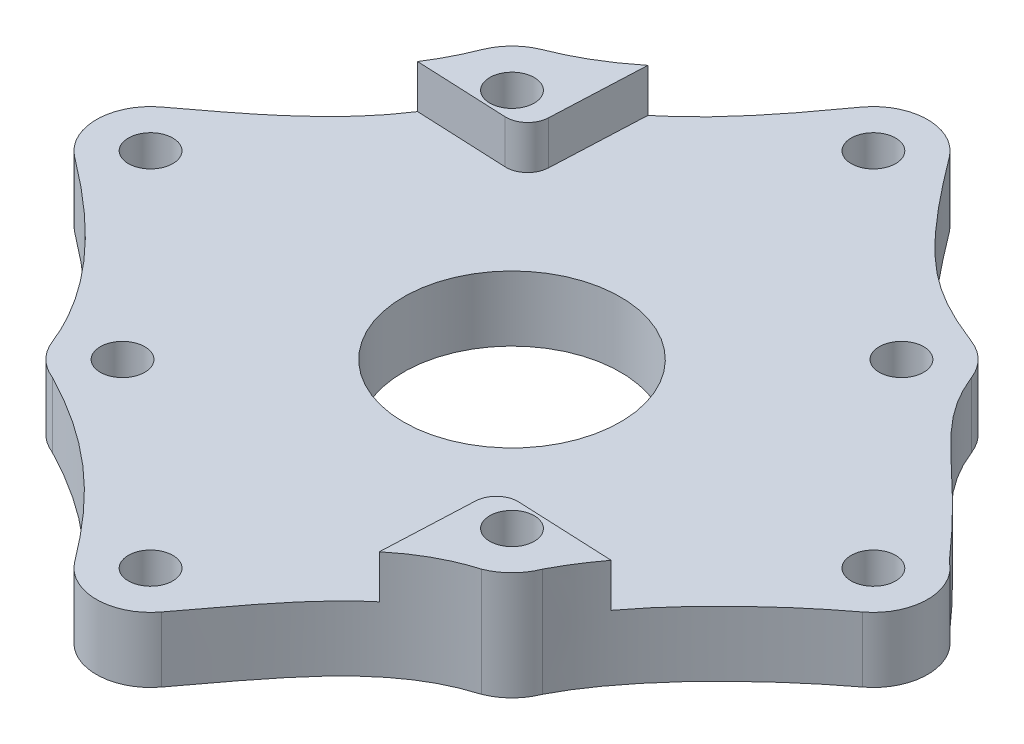
from build123d import *

# Parameters (mm, degrees)
SKETCH2_R           = 2.05
SKETCH2_R_2         = 10
BOSS_EXTRUDE1_DEPTH = 6
SKETCH4_R           = 2.05
BOSS_EXTRUDE2_DEPTH = 4


with BuildPart() as part:
    # Sketch2 → Boss-Extrude1 (new body)
    with BuildSketch(Plane(origin=(0, 0, 0), x_dir=(1, 0, 0), z_dir=(0, 1, 0))):
        with BuildLine():
            ThreePointArc((4, 36.333013665), (0, 38.333013665), (-4, 36.333013665))
            add(Edge.make_bspline(
                [(-19.327049621, 22.155476746), (-12.763587626, 24.730553465), (-8.427522415, 30.156498127), (-4, 36.333013665)],
                knots=[0, 0, 0, 0, 1, 1, 1, 1], degree=3))
            ThreePointArc((-19.327049621, 22.155476746), (-21.03642674, 21.03642674), (-22.155476746, 19.327049621))
            add(Edge.make_bspline(
                [(-36.333013665, 4), (-30.505064465, 8.3709619), (-24.839849632, 12.485009038), (-22.155476746, 19.327049621)],
                knots=[0, 0, 0, 0, 1, 1, 1, 1], degree=3))
            ThreePointArc((-36.333013665, 4), (-38.333013665, 0), (-36.333013665, -4))
            add(Edge.make_bspline(
                [(-36.333013665, -4), (-30.114152071, -8.664146195), (-24.942929086, -13.853392219), (-22.615096154, -19.786669029)],
                knots=[0, 0, 0, 0, 1, 1, 1, 1], degree=3))
            ThreePointArc((-22.615096154, -19.786669029), (-21.496046148, -21.496046148), (-19.786669029, -22.615096154))
            add(Edge.make_bspline(
                [(-19.786669029, -22.615096154), (-12.829111765, -26.205220822), (-8.517950555, -30.309079592), (-4, -36.333013665)],
                knots=[0, 0, 0, 0, 1, 1, 1, 1], degree=3))
            ThreePointArc((-4, -36.333013665), (0, -38.333013665), (4, -36.333013665))
            add(Edge.make_bspline(
                [(4, -36.333013665), (8.986714341, -29.68406121), (12.829629407, -24.073808118), (19.327049621, -22.155476746)],
                knots=[0, 0, 0, 0, 1, 1, 1, 1], degree=3))
            ThreePointArc((19.327049621, -22.155476746), (21.03642674, -21.03642674), (22.155476746, -19.327049621))
            add(Edge.make_bspline(
                [(22.155476746, -19.327049621), (25.018370869, -13.753003663), (31.354300327, -7.734035003), (36.333013665, -4)],
                knots=[0, 0, 0, 0, 1, 1, 1, 1], degree=3))
            ThreePointArc((36.333013665, -4), (38.333013665, 0), (36.333013665, 4))
            add(Edge.make_bspline(
                [(36.333013665, 4), (28.974985707, 12.434827797), (24.849369186, 14.09186156), (22.615096154, 19.786669029)],
                knots=[0, 0, 0, 0, 1, 1, 1, 1], degree=3))
            ThreePointArc((22.615096154, 19.786669029), (21.496046148, 21.496046148), (19.786669029, 22.615096154))
            add(Edge.make_bspline(
                [(4, 36.333013665), (10.902815442, 27.129259742), (13.673195705, 25.013626509), (19.786669029, 22.615096154)],
                knots=[0, 0, 0, 0, 1, 1, 1, 1], degree=3))
        make_face()
        with Locations(Location((0, 33.333013665, 0), (0, 0, 270))):
            Circle(SKETCH2_R, mode=Mode.SUBTRACT)
        with Locations(Location((33.333013665, 0, 0), (0, 0, 270))):
            Circle(SKETCH2_R, mode=Mode.SUBTRACT)
        with Locations(Location((0, -33.333013665, 0), (0, 0, 270))):
            Circle(SKETCH2_R, mode=Mode.SUBTRACT)
        with Locations(Location((-33.333013665, 0, 0), (0, 0, 270))):
            Circle(SKETCH2_R, mode=Mode.SUBTRACT)
        with Locations(Location((0, 0, 0), (0, 0, 270))):
            Circle(SKETCH2_R_2, mode=Mode.SUBTRACT)
        with Locations(Location((-17.500892834, 17.500892834, 0), (0, 0, 270))):
            Circle(SKETCH2_R, mode=Mode.SUBTRACT)
        with Locations(Location((-17.960512242, -17.960512242, 0), (0, 0, 270))):
            Circle(SKETCH2_R, mode=Mode.SUBTRACT)
        with Locations(Location((17.960512242, 17.960512242, 0), (0, 0, 270))):
            Circle(SKETCH2_R, mode=Mode.SUBTRACT)
        with Locations(Location((17.500892834, -17.500892834, 0), (0, 0, 270))):
            Circle(SKETCH2_R, mode=Mode.SUBTRACT)
    extrude(amount=BOSS_EXTRUDE1_DEPTH)

    # Sketch4 → Boss-Extrude2 (add)
    # profile 1 of 2: a face of its own
    with BuildSketch(Plane(origin=(0, 6, 0), x_dir=(1, 0, 0), z_dir=(0, 1, 0))):
        with BuildLine():
            Line((15.707753118, -15.068373573), (24.606369586, -15.466232362))
            add(Edge.make_bspline(
                [(22.155476746, -19.327049621), (22.810102957, -18.052494423), (23.646316442, -16.75467649), (24.606369586, -15.466232362)],
                knots=[0, 0, 0, 0, 0.228658897, 0.228658897, 0.228658897, 0.228658897], degree=3))
            ThreePointArc((22.155476746, -19.327049621), (21.03642674, -21.03642674), (19.327049621, -22.155476746))
            add(Edge.make_bspline(
                [(13.240425147, -25.476068549), (15.048020958, -23.982995667), (17.020234836, -22.836552469), (19.327049621, -22.155476746)],
                knots=[0.644964508, 0.644964508, 0.644964508, 0.644964508, 1, 1, 1, 1], degree=3))
            Line((13.240425147, -25.476068549), (13.620417999, -16.977046436))
            ThreePointArc((13.620417999, -16.977046436), (14.268786465, -15.590408746), (15.707753118, -15.068373573))
        make_face()
        with Locations(Location((17.500892834, -17.500892834, 0), (0, 0, 270))):
            Circle(SKETCH4_R, mode=Mode.SUBTRACT)
    # profile 2 of 2: a face of its own
    with BuildSketch(Plane(origin=(0, 6, 0), x_dir=(1, 0, 0), z_dir=(0, 1, 0))):
        with BuildLine():
            Line((-13.228436316, 25.756908597), (-13.620382808, 16.977307181))
            ThreePointArc((-13.620382808, 16.977307181), (-14.2686581, 15.590625928), (-15.707589672, 15.068494066))
            Line((-15.707589672, 15.068494066), (-24.152657128, 15.445506006))
            add(Edge.make_bspline(
                [(-22.155476746, 19.327049621), (-22.704535018, 17.927587199), (-23.378300091, 16.642253384), (-24.152657128, 15.445506006)],
                knots=[0, 0, 0, 0, 0.204538749, 0.204538749, 0.204538749, 0.204538749], degree=3))
            ThreePointArc((-22.155476746, 19.327049621), (-21.03642674, 21.03642674), (-19.327049621, 22.155476746))
            add(Edge.make_bspline(
                [(-13.228436316, 25.756908597), (-15.059327702, 24.27409121), (-17.060362093, 23.044777893), (-19.327049621, 22.155476746)],
                knots=[0.65465062, 0.65465062, 0.65465062, 0.65465062, 1, 1, 1, 1], degree=3))
        make_face()
        with Locations(Location((-17.500892834, 17.500892834, 0), (0, 0, 270))):
            Circle(SKETCH4_R, mode=Mode.SUBTRACT)
    extrude(amount=BOSS_EXTRUDE2_DEPTH)


solid = part.part
